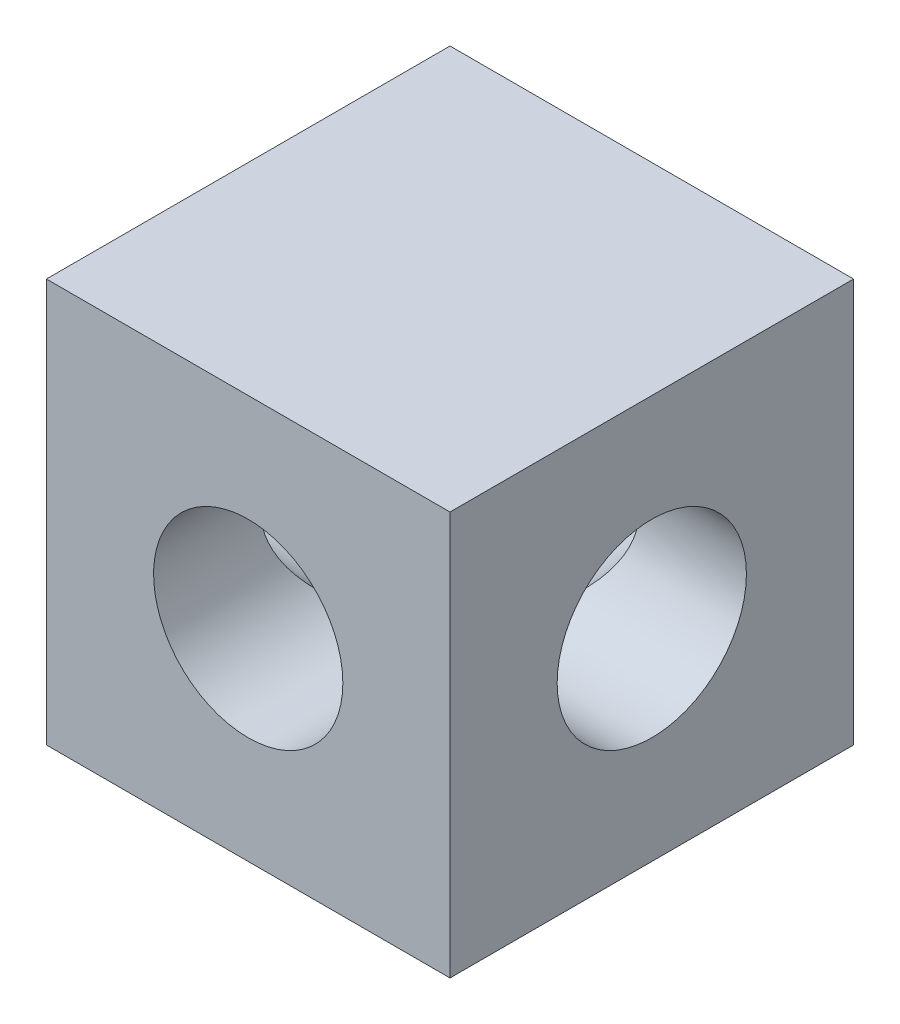
from build123d import *

# Parameters (mm, degrees)
SKETCH1_W               = 20.32
SKETCH1_H               = 20.32
SKETCH1_R               = 4.765
BOSS_EXTRUDE1_DEPTH     = 20.32
CUT_EXTRUDE1_DEPTH      = 18.597636205
CUT_EXTRUDE1_DEPTH_BACK = 18.597636205
SKETCH2_R               = 4.765


with BuildPart() as part:
    # Sketch1 → Boss-Extrude1 (new body)
    with BuildSketch(Plane.XY):
        Rectangle(SKETCH1_W, SKETCH1_H)
        Circle(SKETCH1_R, mode=Mode.SUBTRACT)
    extrude(amount=BOSS_EXTRUDE1_DEPTH)

    # Sketch2 → Cut-Extrude1 (cut, two sides: drawn at the far end of the back side and taken through both)
    with BuildSketch(Plane(origin=(0, 0, 10.16), x_dir=(0, 0, -1), z_dir=(1, 0, 0)).offset(-CUT_EXTRUDE1_DEPTH_BACK)):
        Circle(SKETCH2_R)
    extrude(amount=CUT_EXTRUDE1_DEPTH + CUT_EXTRUDE1_DEPTH_BACK, mode=Mode.SUBTRACT)


solid = part.part
